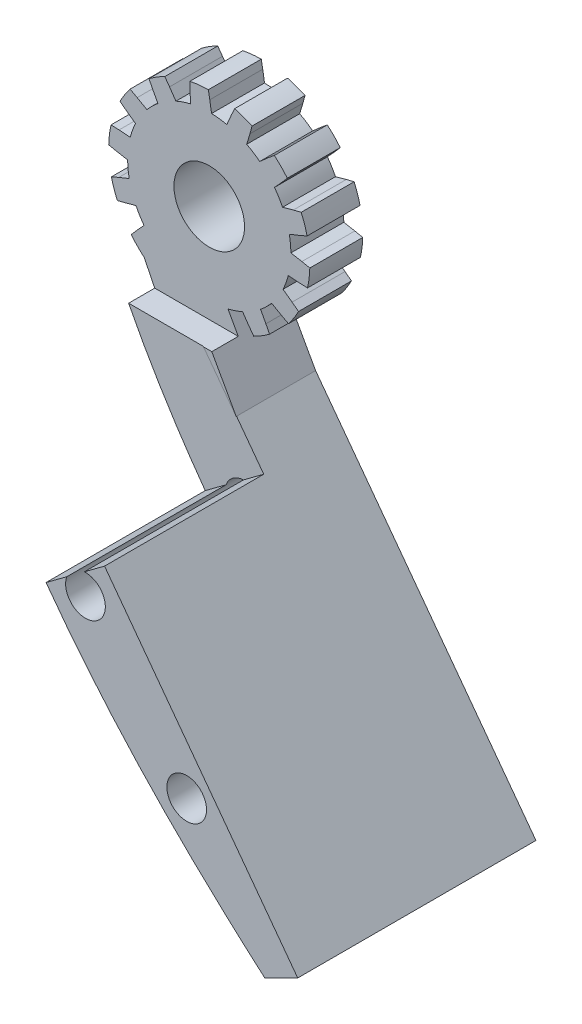
from build123d import *

# Parameters (mm, degrees)
BOSS_EXTRUDE1_DEPTH      = 2
BOSS_EXTRUDE1_DEPTH_BACK = 7
BOSS_EXTRUDE3_DEPTH      = 9
SKETCH6_R                = 4
CUT_EXTRUDE1_DEPTH       = 18
BOSS_EXTRUDE4_DEPTH      = 18
SKETCH8_R                = 2.25
CUT_EXTRUDE2_DEPTH       = 69.863255609
CUT_EXTRUDE3_DEPTH       = 67.431528446
CUT_EXTRUDE3_DEPTH_BACK  = 67.431528446
SKETCH9_W                = 10.323299019
SKETCH9_H                = 27.481333942
SKETCH10_W               = 25.230248524
SKETCH10_H               = 17.693033904
CUT_EXTRUDE4_DEPTH       = 67.436499079


with BuildPart() as part:
    # Sketch2 → Boss-Extrude1 (new, two sides: drawn at the far end of the back side and taken through both)
    with BuildSketch(Plane.XY.offset(-BOSS_EXTRUDE1_DEPTH_BACK)):
        with BuildLine():
            Line((17.593003447, 3.447921134), (18.432689254, 3.812129579))
            ThreePointArc((18.432689254, 3.812129579), (18.142308848, 4.822341152), (17.760116965, 5.801513031))
            Line((17.760116965, 5.801513031), (16.871688472, 5.581479263))
            Line((16.871688472, 5.581479263), (15.649099733, 5.241598415))
            ThreePointArc((15.649099733, 5.241598415), (15.22663553, 6.009376293), (14.733410626, 6.733729845))
            Line((14.733410626, 6.733729845), (15.590096731, 7.669855443))
            Line((15.590096731, 7.669855443), (16.188603379, 8.362321932))
            ThreePointArc((16.188603379, 8.362321932), (15.488665299, 9.146499772), (14.719475556, 9.862876308))
            Line((14.719475556, 9.862876308), (14.014498216, 9.279158058))
            Line((14.014498216, 9.279158058), (13.060452596, 8.442474621))
            ThreePointArc((13.060452596, 8.442474621), (12.346699165, 8.950918239), (11.588033655, 9.389535972))
            Line((11.588033655, 9.389535972), (11.95371149, 10.604658163))
            Line((11.95371149, 10.604658163), (12.192497398, 11.488231214))
            ThreePointArc((12.192497398, 11.488231214), (11.221632964, 11.891059284), (10.217792822, 12.202753318))
            Line((10.217792822, 12.202753318), (9.835896044, 11.370963143))
            Line((9.835896044, 11.370963143), (9.33935398, 10.203192533))
            ThreePointArc((9.33935398, 10.203192533), (8.475678941, 10.351598396), (7.601835833, 10.417606691))
            Line((7.601835833, 10.417606691), (7.404078418, 11.671055622))
            Line((7.404078418, 11.671055622), (7.235849109, 12.570732756))
            ThreePointArc((7.235849109, 12.570732756), (6.18634993, 12.512426015), (5.14668224, 12.357702722))
            Line((5.14668224, 12.357702722), (5.163505363, 11.442586867))
            Line((5.163505363, 11.442586867), (5.222813101, 10.175020376))
            ThreePointArc((5.222813101, 10.175020376), (4.380277888, 9.933994883), (3.564332526, 9.614319987))
            Line((3.564332526, 9.614319987), (2.842308143, 10.657834724))
            Line((2.842308143, 10.657834724), (2.300383494, 11.395423851))
            ThreePointArc((2.300383494, 11.395423851), (1.380115753, 10.887530665), (0.510539453, 10.297034891))
            Line((0.510539453, 10.297034891), (0.922750452, 9.479843274))
            Line((0.922750452, 9.479843274), (1.526161366, 8.363537991))
            ThreePointArc((1.526161366, 8.363537991), (0.871640411, 7.780819197), (0.275200782, 7.138776643))
            Line((0.275200782, 7.138776643), (-0.828084785, 7.765676295))
            Line((-0.828084785, 7.765676295), (-1.636369952, 8.195088843))
            ThreePointArc((-1.636369952, 8.195088843), (-2.245135941, 7.338203686), (-2.772390602, 6.42889036))
            Line((-2.772390602, 6.42889036), (-2.04643517, 5.871477804))
            Line((-2.04643517, 5.871477804), (-1.018434012, 5.12753168))
            ThreePointArc((-1.018434012, 5.12753168), (-1.355304806, 4.318534189), (-1.61410652, 3.481288379))
            Line((-1.61410652, 3.481288379), (-2.880134034, 3.567407782))
            Line((-2.880134034, 3.567407782), (-3.794688927, 3.603593329))
            ThreePointArc((-3.794688927, 3.603593329), (-3.971379595, 2.567432815), (-4.051883364, 1.519402593))
            Line((-4.051883364, 1.519402593), (-3.155967876, 1.332171491))
            Line((-3.155967876, 1.332171491), (-1.90698471, 1.107932181))
            ThreePointArc((-1.90698471, 1.107932181), (-1.859483953, 0.232887867), (-1.729388897, -0.633734398))
            Line((-1.729388897, -0.633734398), (-2.907406081, -1.105452248))
            Line((-2.907406081, -1.105452248), (-3.747091888, -1.469660694))
            ThreePointArc((-3.747091888, -1.469660694), (-3.456711482, -2.479872267), (-3.0745196, -3.459044145))
            Line((-3.0745196, -3.459044145), (-2.186091107, -3.239010378))
            Line((-2.186091107, -3.239010378), (-0.963502367, -2.899129529))
            ThreePointArc((-0.963502367, -2.899129529), (-0.541038164, -3.666907408), (-0.047813261, -4.391260959))
            Line((-0.047813261, -4.391260959), (-0.904499365, -5.327386558))
            Line((-0.904499365, -5.327386558), (-1.503006014, -6.019853046))
            ThreePointArc((-1.503006014, -6.019853046), (-0.803067933, -6.804030887), (-0.03387819, -7.520407423))
            Line((-0.03387819, -7.520407423), (0.67109915, -6.936689172))
            Line((0.67109915, -6.936689172), (1.625144769, -6.100005735))
            ThreePointArc((1.625144769, -6.100005735), (2.3388982, -6.608449353), (3.097563711, -7.047067087))
            Line((3.097563711, -7.047067087), (2.731885876, -8.262189278))
            Line((2.731885876, -8.262189278), (2.493099968, -9.145762328))
            ThreePointArc((2.493099968, -9.145762328), (3.463964401, -9.548590398), (4.467804544, -9.860284433))
            Line((4.467804544, -9.860284433), (4.849701322, -9.028494257))
            Line((4.849701322, -9.028494257), (5.346243386, -7.860723648))
            ThreePointArc((5.346243386, -7.860723648), (6.209918425, -8.009129511), (7.083761533, -8.075137806))
            Line((7.083761533, -8.075137806), (7.281518948, -9.328586736))
            Line((7.281518948, -9.328586736), (7.449748257, -10.22826387))
            ThreePointArc((7.449748257, -10.22826387), (8.499247436, -10.16995713), (9.538915126, -10.015233837))
            Line((9.538915126, -10.015233837), (9.522092003, -9.100117982))
            Line((9.522092003, -9.100117982), (9.462784265, -7.83255149))
            ThreePointArc((9.462784265, -7.83255149), (10.305319478, -7.591525998), (11.12126484, -7.271851101))
            Line((11.12126484, -7.271851101), (11.843289223, -8.315365839))
            Line((11.843289223, -8.315365839), (12.385213872, -9.052954966))
            ThreePointArc((12.385213872, -9.052954966), (13.305481612, -8.54506178), (14.175057913, -7.954566005))
            Line((14.175057913, -7.954566005), (13.762846914, -7.137374389))
            Line((13.762846914, -7.137374389), (13.159436, -6.021069105))
            ThreePointArc((13.159436, -6.021069105), (13.813956955, -5.438350311), (14.410396584, -4.796307757))
            Line((14.410396584, -4.796307757), (15.513682151, -5.42320741))
            Line((15.513682151, -5.42320741), (16.321967317, -5.852619957))
            ThreePointArc((16.321967317, -5.852619957), (16.930733307, -4.9957348), (17.457987967, -4.086421474))
            Line((17.457987967, -4.086421474), (16.732032536, -3.529008918))
            Line((16.732032536, -3.529008918), (15.704031377, -2.785062794))
            ThreePointArc((15.704031377, -2.785062794), (16.040902172, -1.976065303), (16.299703886, -1.138819493))
            Line((16.299703886, -1.138819493), (17.565731399, -1.224938896))
            Line((17.565731399, -1.224938896), (18.480286292, -1.261124443))
            ThreePointArc((18.480286292, -1.261124443), (18.656976961, -0.22496393), (18.737480729, 0.823066292))
            Line((18.737480729, 0.823066292), (17.841565242, 1.010297394))
            Line((17.841565242, 1.010297394), (16.592582076, 1.234536705))
            ThreePointArc((16.592582076, 1.234536705), (16.545081318, 2.109581019), (16.414986263, 2.976203284))
            Line((16.414986263, 2.976203284), (17.593003447, 3.447921134))
        make_face()
    extrude(amount=BOSS_EXTRUDE1_DEPTH + BOSS_EXTRUDE1_DEPTH_BACK)

    # Sketch5 → Boss-Extrude3 (add)
    with BuildSketch(Plane.XY.offset(2)):
        with BuildLine():
            Line((34.627961915, -50.407866333), (38.369192873, -48.55177457))
            Line((38.369192873, -48.55177457), (13.393984011, -14.920355903))
            Line((13.393984011, -14.920355903), (9.462784265, -7.83255149))
            Line((9.462784265, -7.83255149), (0.865656202, -2.843190202))
            Line((0.865656202, -2.843190202), (-0.03387819, -7.520407423))
            add(Edge.make_bspline(
                [(34.627961915, -50.407866333), (20.737528927, -38.343464696), (7.957182105, -24.264537371), (-0.03387819, -7.520407423)],
                knots=[0, 0, 0, 0, 1, 1, 1, 1], degree=3))
        make_face()
    extrude(amount=-BOSS_EXTRUDE3_DEPTH)

    # Sketch6 → Cut-Extrude1 (cut)
    with BuildSketch(Plane(origin=(0, 0, -7), x_dir=(-1, 0, 0), z_dir=(0, 0, -1))):
        with Locations((-7.342798683, 1.171234443)):
            Circle(SKETCH6_R)
    extrude(amount=-CUT_EXTRUDE1_DEPTH, mode=Mode.SUBTRACT)

    # Sketch7 → Boss-Extrude4 (add)
    with BuildSketch(Plane.XY.offset(2)):
        with BuildLine():
            Line((34.627961915, -50.407866333), (38.369192873, -48.55177457))
            Line((38.369192873, -48.55177457), (13.393984011, -14.920355903))
            add(Edge.make_bspline(
                [(7.977955023, -21.345123668), (8.112113434, -15.921271934), (13.393984011, -14.920355903)],
                knots=[0, 0, 0, 1, 1, 1], degree=2))
            add(Edge.make_bspline(
                [(7.977955023, -21.345123668), (15.413845314, -32.210109704), (24.739621619, -41.819443715), (34.627961915, -50.407866333)],
                knots=[0.288118642, 0.288118642, 0.288118642, 0.288118642, 1, 1, 1, 1], degree=3))
        make_face()
    extrude(amount=BOSS_EXTRUDE4_DEPTH)

    # Sketch8 → Cut-Extrude2 (cut, through all)
    with BuildSketch(Plane(origin=(0, 0, -7), x_dir=(-1, 0, 0), z_dir=(0, 0, -1))):
        with Locations((-14.312794722, -23.020807584)):
            Circle(SKETCH8_R)
        with Locations((-25.785580409, -37.215397344)):
            Circle(SKETCH8_R)
    extrude(amount=-CUT_EXTRUDE2_DEPTH, mode=Mode.SUBTRACT)

    # Sketch9 → Cut-Extrude3 (cut, two sides: drawn at the far end of the back side and taken through both)
    with BuildSketch(Plane(origin=(0, 0, 0), x_dir=(0, 0, -1), z_dir=(1, 0, 0)).offset(-CUT_EXTRUDE3_DEPTH_BACK)):
        with Locations((-4.16164951, 3.801629666)):
            Rectangle(SKETCH9_W, SKETCH9_H)
    extrude(amount=CUT_EXTRUDE3_DEPTH + CUT_EXTRUDE3_DEPTH_BACK, mode=Mode.SUBTRACT)

    # Sketch10 → Cut-Extrude4 (cut, through all)
    with BuildSketch(Plane(origin=(1.491415785, 1.107548305, 0), x_dir=(0, 0, -1), z_dir=(0.8028367498889462, 0.5961989206865052, 0))):
        with Locations((-14.573721534, -16.286562524)):
            Rectangle(SKETCH10_W, SKETCH10_H)
    extrude(amount=-CUT_EXTRUDE4_DEPTH, mode=Mode.SUBTRACT)


solid = part.part
